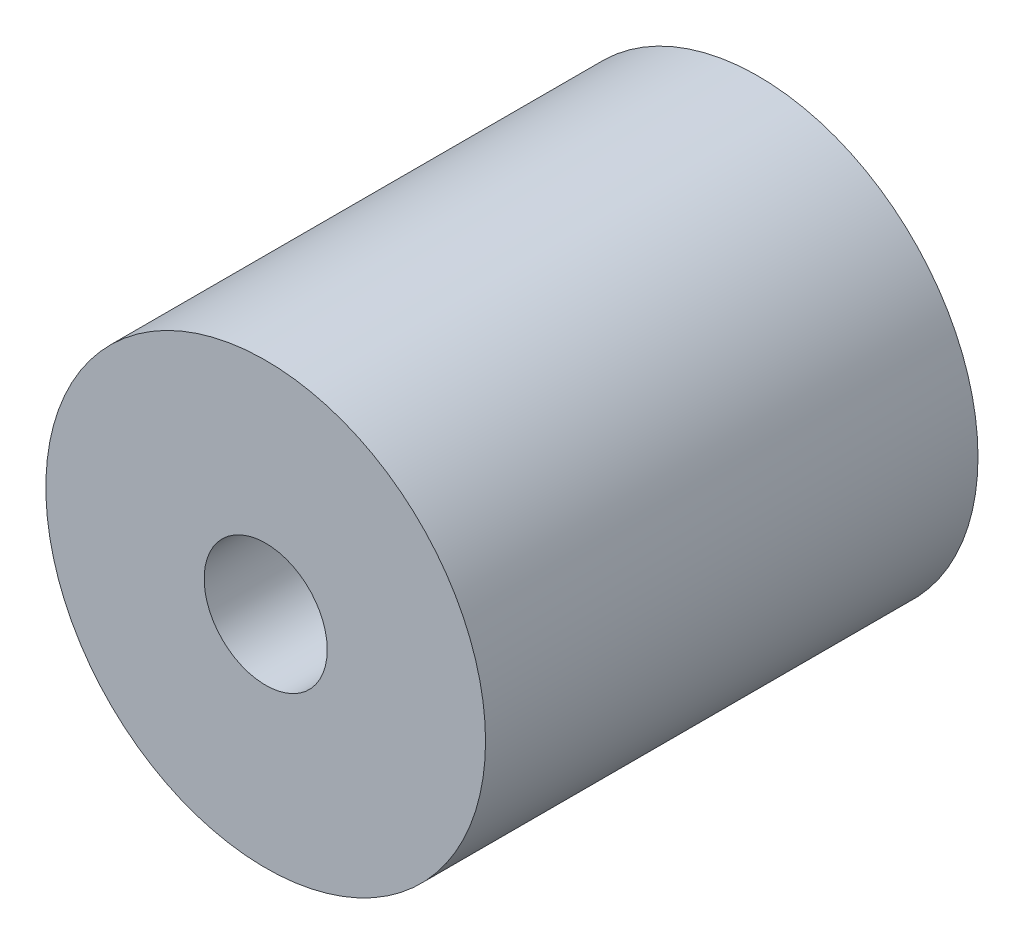
from build123d import *

# Parameters (mm, degrees)
SKETCH2_R           = 6.25
BOSS_EXTRUDE1_DEPTH = 14
SKETCH4_R           = 1.75
CUT_EXTRUDE1_DEPTH  = 5.5
CUT_EXTRUDE2_START  = -14
SKETCH4_3_R         = 3.375
CUT_EXTRUDE2_DEPTH  = 5.5


with BuildPart() as part:
    # Sketch2 → Boss-Extrude1 (new body)
    with BuildSketch(Plane.XY):
        Circle(SKETCH2_R)
    extrude(amount=BOSS_EXTRUDE1_DEPTH)

    # Sketch4 → Cut-Extrude1 (cut)
    with BuildSketch(Plane.XY.offset(14)):
        Circle(SKETCH4_R)
    extrude(amount=-CUT_EXTRUDE1_DEPTH, mode=Mode.SUBTRACT)

    # Sketch4<3> → Cut-Extrude2 (cut)
    with BuildSketch(Plane.XY.offset(14).offset(CUT_EXTRUDE2_START)):
        Circle(SKETCH4_3_R)
    extrude(amount=CUT_EXTRUDE2_DEPTH, mode=Mode.SUBTRACT)


solid = part.part
